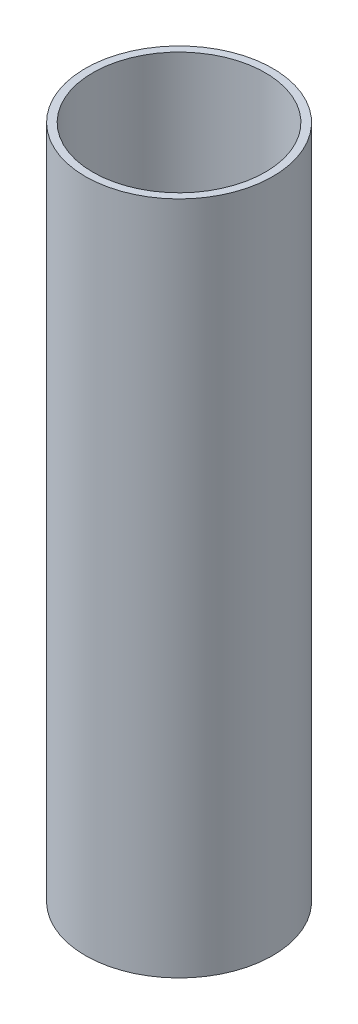
from build123d import *

# Parameters (mm, degrees)
SKETCH1_R           = 15.875
SKETCH1_R_2         = 14.605
BOSS_EXTRUDE1_DEPTH = 114.3


with BuildPart() as part:
    # Sketch1 → Boss-Extrude1 (new body)
    with BuildSketch(Plane(origin=(0, 0, 0), x_dir=(1, 0, 0), z_dir=(0, 1, 0))):
        with Locations(Location((0, 0, 0), (0, 0, 270))):
            Circle(SKETCH1_R)
        with Locations(Location((0, 0, 0), (0, 0, 270))):
            Circle(SKETCH1_R_2, mode=Mode.SUBTRACT)
    extrude(amount=BOSS_EXTRUDE1_DEPTH)


solid = part.part
